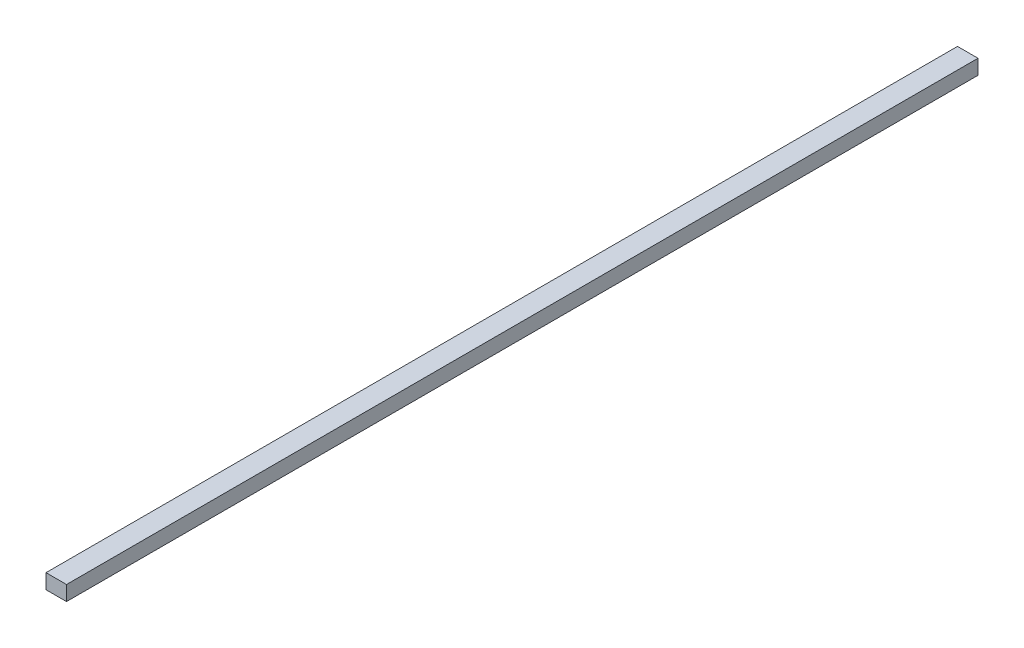
from build123d import *

# Parameters (mm, degrees)
SKETCH_1_W      = 9
SKETCH_1_H      = 6.5
EXTRUDE_1_DEPTH = 400


with BuildPart() as part:
    # 草图1 → 凸台-拉伸1 (new body)
    with BuildSketch(Plane.XY):
        with Locations((4.5, 3.25)):
            Rectangle(SKETCH_1_W, SKETCH_1_H)
    extrude(amount=EXTRUDE_1_DEPTH)


solid = part.part
